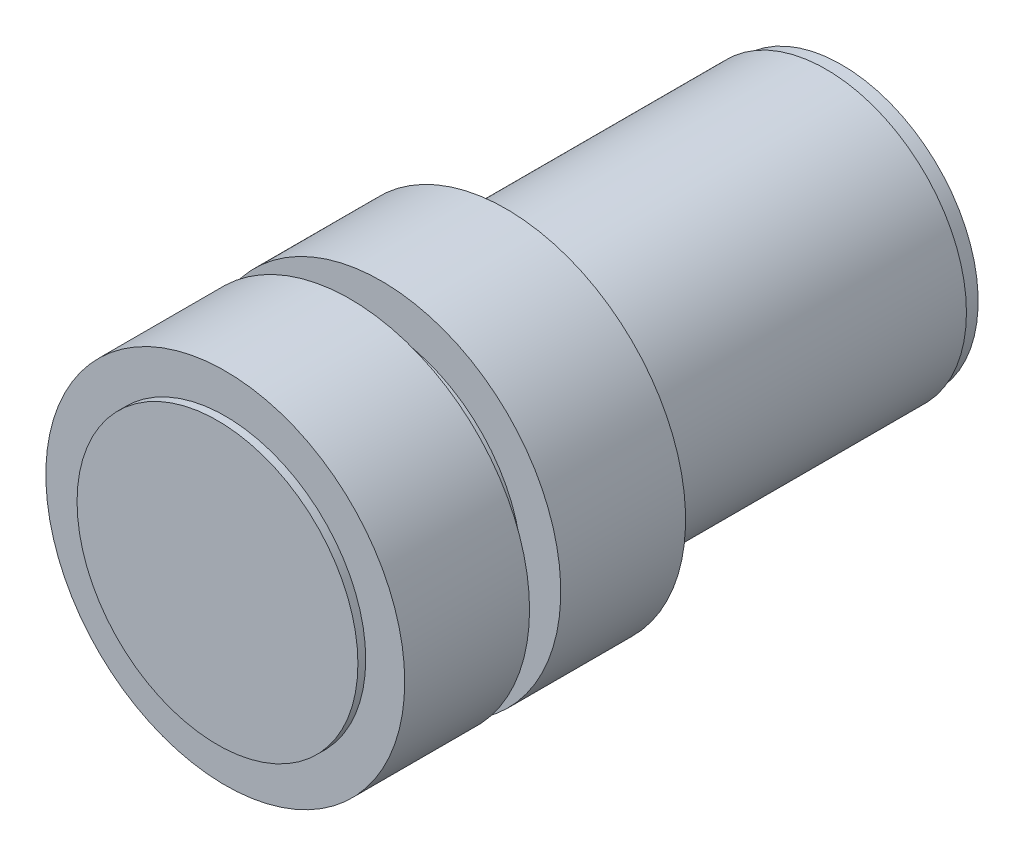
from build123d import *

# Parameters (mm, degrees)
SKETCH1_R           = 9
BOSS_EXTRUDE1_DEPTH = 40
BOSS_EXTRUDE5_START = -0.5
SKETCH4_R           = 11.5
BOSS_EXTRUDE5_DEPTH = 8
BOSS_EXTRUDE6_START = 2
SKETCH5_R           = 11.5
BOSS_EXTRUDE6_DEPTH = 8
SKETCH6_R           = 9
SKETCH6_R_2         = 8.75
CUT_EXTRUDE1_DEPTH  = 1


with BuildPart() as part:
    # Sketch1 → Boss-Extrude1 (new body)
    with BuildSketch(Plane.XY):
        Circle(SKETCH1_R)
    extrude(amount=BOSS_EXTRUDE1_DEPTH)

    # Sketch4 → Boss-Extrude5 (add)
    with BuildSketch(Plane.XY.offset(40).offset(BOSS_EXTRUDE5_START)):
        Circle(SKETCH4_R)
    extrude(amount=-BOSS_EXTRUDE5_DEPTH)

    # Sketch5 → Boss-Extrude6 (add)
    with BuildSketch(Plane(origin=(0, 0, 31.5), x_dir=(-1, 0, 0), z_dir=(0, 0, -1)).offset(BOSS_EXTRUDE6_START)):
        with Locations(Location((0, 0, 0), (0, 0, 180))):
            Circle(SKETCH5_R)
    extrude(amount=BOSS_EXTRUDE6_DEPTH)

    # Sketch6 → Cut-Extrude1 (cut)
    with BuildSketch(Plane(origin=(0, 0, 0), x_dir=(-1, 0, 0), z_dir=(0, 0, -1))):
        Circle(SKETCH6_R)
        Circle(SKETCH6_R_2, mode=Mode.SUBTRACT)
    extrude(amount=-CUT_EXTRUDE1_DEPTH, mode=Mode.SUBTRACT)


solid = part.part
